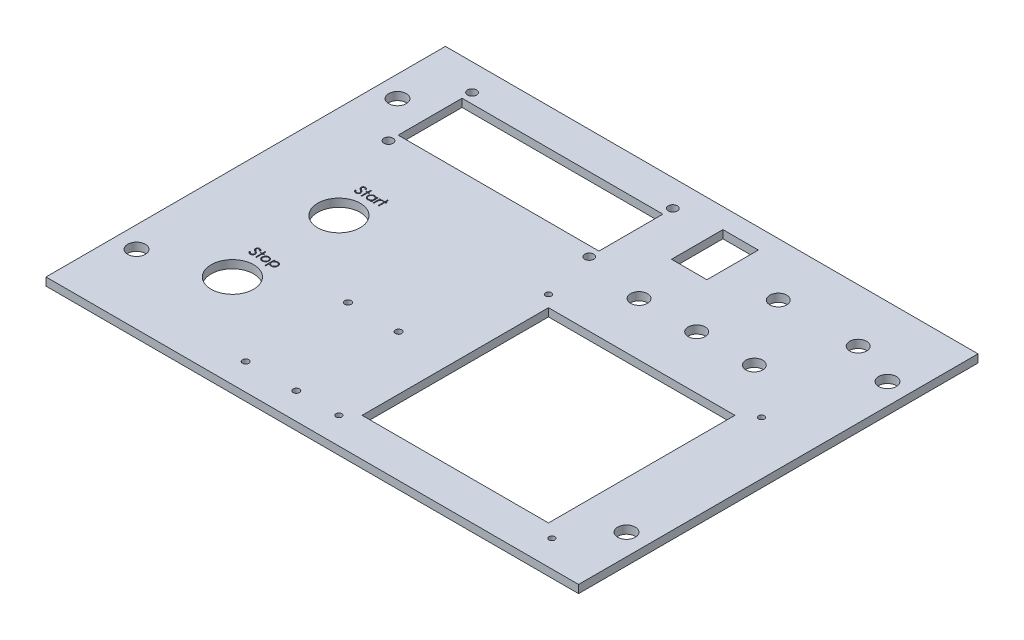
from build123d import *

# Parameters (mm, degrees)
SKETCH1_W           = 200
SKETCH1_H           = 150
BOSS_EXTRUDE1_DEPTH = 3
SKETCH2_R           = 3.3
SKETCH2_R_2         = 1.2
SKETCH2_R_3         = 1.1
SKETCH2_R_4         = 7.985
SKETCH2_R_5         = 3.175
SKETCH2_R_6         = 1.7
SKETCH2_W           = 13.3
SKETCH2_H           = 19.3
SKETCH2_W_2         = 70
SKETCH2_H_2         = 70
SKETCH2_W_3         = 75.4
SKETCH2_H_3         = 24
CUT_EXTRUDE1_DEPTH  = 3
CUT_EXTRUDE2_DEPTH  = 1


with BuildPart() as part:
    # Sketch1 → Boss-Extrude1 (new body)
    with BuildSketch(Plane(origin=(0, 0, 0), x_dir=(1, 0, 0), z_dir=(0, 1, 0))):
        with Locations((100, 75)):
            Rectangle(SKETCH1_W, SKETCH1_H)
    extrude(amount=BOSS_EXTRUDE1_DEPTH)

    # Sketch2 → Cut-Extrude1 (cut)
    with BuildSketch(Plane(origin=(0, 3, 0), x_dir=(1, 0, 0), z_dir=(0, 1, 0))):
        with Locations(Location((8, 124, 0), (0, 0, 270))):
            Circle(SKETCH2_R)
        with Locations(Location((8, 26, 0), (0, 0, 90))):
            Circle(SKETCH2_R)
        with Locations(Location((192, 26, 0), (0, 0, 270))):
            Circle(SKETCH2_R)
        with Locations(Location((192, 124, 0), (0, 0, 90))):
            Circle(SKETCH2_R)
        with Locations(Location((65, 48.4, 0), (0, 0, 270))):
            Circle(SKETCH2_R_2)
        with Locations(Location((84, 48.4, 0), (0, 0, 270))):
            Circle(SKETCH2_R_2)
        with Locations(Location((65, 10, 0), (0, 0, 270))):
            Circle(SKETCH2_R_2)
        with Locations(Location((84, 10, 0), (0, 0, 270))):
            Circle(SKETCH2_R_2)
        with Locations(Location((100, 88.7, 0), (0, 0, 270))):
            Circle(SKETCH2_R_3)
        with Locations(Location((180, 88.7, 0), (0, 0, 270))):
            Circle(SKETCH2_R_3)
        with Locations(Location((180, 10, 0), (0, 0, 270))):
            Circle(SKETCH2_R_3)
        with Locations(Location((100, 10, 0), (0, 0, 270))):
            Circle(SKETCH2_R_3)
        with Locations(Location((35, 35, 0), (0, 0, 270))):
            Circle(SKETCH2_R_4)
        with Locations(Location((35, 75, 0), (0, 0, 270))):
            Circle(SKETCH2_R_4)
        with Locations(Location((145, 130, 0), (0, 0, 270))):
            Circle(SKETCH2_R_5)
        with Locations(Location((175, 130, 0), (0, 0, 270))):
            Circle(SKETCH2_R_5)
        with Locations(Location((20, 140, 0), (0, 0, 270))):
            Circle(SKETCH2_R_6)
        with Locations(Location((95.4, 140, 0), (0, 0, 270))):
            Circle(SKETCH2_R_6)
        with Locations(Location((95.4, 108.6, 0), (0, 0, 270))):
            Circle(SKETCH2_R_6)
        with Locations(Location((20, 108.6, 0), (0, 0, 270))):
            Circle(SKETCH2_R_6)
        with Locations(Location((140, 104.35, 0), (0, 0, 270))):
            Circle(SKETCH2_R_5)
        with Locations(Location((161.65, 104.35, 0), (0, 0, 270))):
            Circle(SKETCH2_R_5)
        with Locations(Location((118.35, 104.35, 0), (0, 0, 270))):
            Circle(SKETCH2_R_5)
        with Locations((118.35, 132.85)):
            Rectangle(SKETCH2_W, SKETCH2_H)
        with Locations((139.35, 49.35)):
            Rectangle(SKETCH2_W_2, SKETCH2_H_2)
        with Locations((57.7, 124.25)):
            Rectangle(SKETCH2_W_3, SKETCH2_H_3)
    extrude(amount=-CUT_EXTRUDE1_DEPTH, mode=Mode.SUBTRACT)

    # Sketch3 → Cut-Extrude2 (cut)
    # profile 1 of 9: a face of its own
    with BuildSketch(Plane(origin=(0, 3, 0), x_dir=(1, 0, 0), z_dir=(0, 1, 0))):
        with BuildLine():
            Line((29.748501989, 86.241905831), (30.044375386, 86.419289645))
            add(Edge.make_bspline(
                [(30.044375386, 86.419289645), (30.071893624, 86.37322526), (30.124617504, 86.284967676), (30.212568863, 86.165709636), (30.303701775, 86.064347479), (30.398691108, 85.981470871), (30.496957056, 85.916221985), (30.59914111, 85.870019753), (30.704898921, 85.841203778), (30.776872742, 85.837703691), (30.812804874, 85.835956312)],
                knots=[0, 0, 0, 0, 1.272034388, 2.437168799, 3.508375237, 4.49857839, 5.41946034, 6.295179144, 7.148887113, 8, 8, 8, 8], degree=3))
            add(Edge.make_bspline(
                [(30.812804874, 85.835956312), (30.843491734, 85.836810984), (30.904328507, 85.838505374), (30.99389075, 85.854786176), (31.080872552, 85.879798305), (31.16348119, 85.915619237), (31.240576805, 85.958957723), (31.3081835, 86.0113039), (31.366629613, 86.069910106), (31.414438728, 86.13529276), (31.451118763, 86.205609909), (31.479310831, 86.27778586), (31.494955905, 86.352954429), (31.497312659, 86.403564892), (31.498501989, 86.42910535)],
                knots=[0, 0, 0, 0, 1.095163259, 2.171163733, 3.241058638, 4.321873601, 5.38011039, 6.391990106, 7.366004449, 8.327778327, 9.272591725, 10.192022065, 11.087607919, 12, 12, 12, 12], degree=3))
            add(Edge.make_bspline(
                [(31.498501989, 86.42910535), (31.497027678, 86.4582462), (31.49403062, 86.517485289), (31.46869914, 86.604884942), (31.428849893, 86.691377512), (31.392087249, 86.744878777), (31.373001188, 86.77265503)],
                knots=[0, 0, 0, 0, 0.938893495, 1.908633276, 2.914225137, 4, 4, 4, 4], degree=3))
            add(Edge.make_bspline(
                [(31.373001188, 86.77265503), (31.357330574, 86.792701853), (31.324432079, 86.834787652), (31.267874567, 86.897432887), (31.201508452, 86.962051306), (31.127604897, 87.031110363), (31.043471809, 87.10139816), (30.951744294, 87.176266438), (30.850080435, 87.252868015), (30.778780939, 87.30424058), (30.741991572, 87.330747978)],
                knots=[0, 0, 0, 0, 0.722233717, 1.516239348, 2.393582979, 3.351407094, 4.387010283, 5.505090956, 6.712668013, 8, 8, 8, 8], degree=3))
            add(Edge.make_bspline(
                [(30.741991572, 87.330747978), (30.705167576, 87.356976566), (30.6347629, 87.407123628), (30.536304317, 87.481547912), (30.448259854, 87.549591782), (30.371020838, 87.611895794), (30.304621241, 87.668468399), (30.24853783, 87.718766338), (30.204199273, 87.764149899), (30.179543692, 87.79359124), (30.168473944, 87.806809677)],
                knots=[0, 0, 0, 0, 1.452282411, 2.77665338, 3.964542531, 5.026858415, 5.96415736, 6.766646006, 7.446254459, 8, 8, 8, 8], degree=3))
            add(Edge.make_bspline(
                [(30.168473944, 87.806809677), (30.153001399, 87.827410714), (30.122572562, 87.867925418), (30.082406557, 87.931250275), (30.048267394, 87.996073541), (30.021505062, 88.062569405), (29.998968843, 88.129804334), (29.983810912, 88.19865558), (29.974319515, 88.268814198), (29.973347529, 88.316027699), (29.972860963, 88.339662241)],
                knots=[0, 0, 0, 0, 1.068054152, 2.10047183, 3.106115577, 4.101338837, 5.06977816, 6.043150881, 7.020423561, 8, 8, 8, 8], degree=3))
            add(Edge.make_bspline(
                [(29.972860963, 88.339662241), (29.974166172, 88.376692016), (29.976748692, 88.449960079), (29.99858921, 88.55699091), (30.033062103, 88.659177327), (30.081356991, 88.755507661), (30.143614344, 88.843473642), (30.215660319, 88.924087129), (30.301471805, 88.991855711), (30.395624428, 89.051067769), (30.4986808, 89.097413694), (30.606671703, 89.132374675), (30.719768776, 89.152183932), (30.79637191, 89.155026697), (30.835240771, 89.156469132)],
                knots=[0, 0, 0, 0, 1.005424448, 1.989358655, 2.955360095, 3.929531133, 4.905563448, 5.876582895, 6.856512386, 7.866279853, 8.892233794, 9.918561126, 10.94386622, 12, 12, 12, 12], degree=3))
            add(Edge.make_bspline(
                [(30.835240771, 89.156469132), (30.876484871, 89.155046581), (30.958506223, 89.152217579), (31.079155439, 89.127620048), (31.195316155, 89.086919376), (31.28875942, 89.040730718), (31.361892181, 88.994599303), (31.417664914, 88.952579478), (31.474182365, 88.90420437), (31.53190042, 88.849345124), (31.589841079, 88.787498373), (31.648864531, 88.719087684), (31.7091088, 88.644531128), (31.74786466, 88.591306627), (31.767732758, 88.564021215)],
                knots=[0, 0, 0, 0, 1.286793592, 2.559021753, 3.825965368, 5.121522368, 5.803751409, 6.523245864, 7.299691795, 8.125521123, 9.008227632, 9.944561021, 10.946284179, 12, 12, 12, 12], degree=3))
            Line((31.767732758, 88.564021215), (31.483778431, 88.348776824))
            add(Edge.make_bspline(
                [(31.483778431, 88.348776824), (31.466632499, 88.370865515), (31.433613442, 88.413403168), (31.383483955, 88.472974484), (31.336235307, 88.527390963), (31.289684907, 88.574656091), (31.246291276, 88.617358225), (31.204174234, 88.653917981), (31.163939882, 88.684693577), (31.113222972, 88.717537137), (31.049505253, 88.75009364), (30.969520717, 88.777642718), (30.885934442, 88.79419778), (30.829004811, 88.796386668), (30.800184681, 88.797494773)],
                knots=[0, 0, 0, 0, 1.181633172, 2.275549214, 3.290209073, 4.226197932, 5.078386478, 5.862611352, 6.581680152, 7.217281963, 8.414376989, 9.595101626, 10.782541182, 12, 12, 12, 12], degree=3))
            add(Edge.make_bspline(
                [(30.800184681, 88.797494773), (30.764028159, 88.796283073), (30.694303712, 88.793946424), (30.595313475, 88.768426439), (30.50621955, 88.728244578), (30.429666985, 88.6719296), (30.365930008, 88.605208608), (30.319824549, 88.528429753), (30.292074385, 88.44364735), (30.288688105, 88.384505694), (30.286963527, 88.354385799)],
                knots=[0, 0, 0, 0, 1.14458467, 2.207223713, 3.21896685, 4.227309161, 5.202851033, 6.127160689, 7.046193047, 8, 8, 8, 8], degree=3))
            add(Edge.make_bspline(
                [(30.286963527, 88.354385799), (30.287356654, 88.33563432), (30.28814355, 88.298100701), (30.299118348, 88.242649279), (30.313217677, 88.187337939), (30.335560309, 88.132415357), (30.366405612, 88.076920998), (30.406910788, 88.01989926), (30.4579241, 87.960847551), (30.497001113, 87.922440178), (30.517632598, 87.902162241)],
                knots=[0, 0, 0, 0, 0.858281714, 1.717966888, 2.583508476, 3.4729293, 4.427298488, 5.488583878, 6.674047936, 8, 8, 8, 8], degree=3))
            add(Edge.make_bspline(
                [(30.517632598, 87.902162241), (30.52529397, 87.895325215), (30.543495638, 87.879082007), (30.576771563, 87.852489726), (30.620714362, 87.819686954), (30.674176563, 87.779099638), (30.738143924, 87.732018175), (30.812623481, 87.679044563), (30.896785013, 87.618459104), (30.956506929, 87.576101564), (30.988085322, 87.553704709)],
                knots=[0, 0, 0, 0, 0.420754252, 0.999615792, 1.744751191, 2.668019286, 3.750313428, 4.999500688, 6.413464383, 8, 8, 8, 8], degree=3))
            add(Edge.make_bspline(
                [(30.988085322, 87.553704709), (31.026071236, 87.526063349), (31.099625692, 87.472539688), (31.204283272, 87.392124008), (31.29917708, 87.313476239), (31.384640284, 87.237098632), (31.461517192, 87.163570539), (31.528954913, 87.092007359), (31.587640593, 87.022921786), (31.650819812, 86.93434921), (31.715377631, 86.825568126), (31.770819138, 86.692289888), (31.805777486, 86.558493567), (31.810349001, 86.468566731), (31.812604553, 86.424197498)],
                knots=[0, 0, 0, 0, 1.163667725, 2.253281268, 3.268753668, 4.215851969, 5.092017293, 5.902905408, 6.650798638, 7.335211899, 8.59617414, 9.77448103, 10.901945474, 12, 12, 12, 12], degree=3))
            add(Edge.make_bspline(
                [(31.812604553, 86.424197498), (31.811947415, 86.392819132), (31.8106459, 86.330671749), (31.795684986, 86.239416672), (31.773765321, 86.150785802), (31.740728087, 86.06587469), (31.700404929, 85.983129927), (31.649238681, 85.904722027), (31.589930996, 85.828915628), (31.521897231, 85.757732137), (31.447451329, 85.692385941), (31.368767634, 85.634256879), (31.285717361, 85.585788556), (31.198751045, 85.546237714), (31.107848708, 85.515304196), (31.013040924, 85.492891327), (30.914171413, 85.479135616), (30.846970931, 85.477707855), (30.812804874, 85.476981953)],
                knots=[0, 0, 0, 0, 0.983748083, 1.948392443, 2.894712957, 3.844097841, 4.80183111, 5.778335162, 6.776009319, 7.81870978, 8.863265674, 9.881300176, 10.883814829, 11.87499822, 12.874611388, 13.892143829, 14.928324115, 16, 16, 16, 16], degree=3))
            add(Edge.make_bspline(
                [(30.812804874, 85.476981953), (30.786369531, 85.477493134), (30.733831771, 85.47850906), (30.656122289, 85.48749034), (30.5799827, 85.500197444), (30.506368418, 85.520371514), (30.434331006, 85.544848491), (30.364183771, 85.574986823), (30.295892717, 85.611104025), (30.229075135, 85.652399049), (30.16390096, 85.700456794), (30.100981492, 85.75643029), (30.038252307, 85.818775795), (29.97756491, 85.889186359), (29.917691766, 85.966524442), (29.859813356, 86.051513625), (29.802731639, 86.143690979), (29.766916171, 86.208556064), (29.748501989, 86.241905831)],
                knots=[0, 0, 0, 0, 0.915332311, 1.819136955, 2.706846663, 3.586547465, 4.459518054, 5.340707479, 6.227863349, 7.133153174, 8.059268498, 9.028702269, 10.047606654, 11.120612155, 12.245963614, 13.433783089, 14.680604001, 16, 16, 16, 16], degree=3))
        make_face()
    # profile 2 of 9: a face of its own
    with BuildSketch(Plane(origin=(0, 3, 0), x_dir=(1, 0, 0), z_dir=(0, 1, 0))):
        Polygon((32.754912245, 89.156469132), (33.06901481, 89.156469132), (33.06901481, 88.12441785), (33.517732758, 88.12441785), (33.517732758, 87.810315286), (33.06901481, 87.810315286), (33.06901481, 85.566725542), (32.754912245, 85.566725542), (32.754912245, 87.810315286), (32.306194297, 87.810315286), (32.306194297, 88.12441785), (32.754912245, 88.12441785), align=None)
    # profile 3 of 9: a face of its own
    with BuildSketch(Plane(origin=(0, 3, 0), x_dir=(1, 0, 0), z_dir=(0, 1, 0))):
        with BuildLine():
            Line((36.658758399, 88.12441785), (36.658758399, 85.566725542))
            Line((36.658758399, 85.566725542), (36.344655835, 85.566725542))
            Line((36.344655835, 85.566725542), (36.344655835, 86.009133395))
            add(Edge.make_bspline(
                [(36.344655835, 86.009133395), (36.309237045, 85.969093801), (36.240116829, 85.89095603), (36.124675711, 85.788873857), (36.002307533, 85.704495536), (35.873606212, 85.63634562), (35.738687969, 85.585153564), (35.597851882, 85.548767405), (35.451040501, 85.52537357), (35.350788146, 85.523037548), (35.299984361, 85.521853748)],
                knots=[0, 0, 0, 0, 1.074387032, 2.096679803, 3.090159297, 4.057316773, 5.018401886, 5.985159533, 6.978961417, 8, 8, 8, 8], degree=3))
            add(Edge.make_bspline(
                [(35.299984361, 85.521853748), (35.254816407, 85.52308012), (35.165743202, 85.52549858), (35.034714125, 85.544260884), (34.908621876, 85.574391505), (34.787347303, 85.616292395), (34.671675157, 85.671873217), (34.560615061, 85.738414465), (34.454742369, 85.817655295), (34.35567083, 85.908243323), (34.264438829, 86.00663831), (34.184377557, 86.111583857), (34.117624477, 86.222626161), (34.061804396, 86.338359315), (34.018808052, 86.459674234), (33.988834418, 86.586151402), (33.970093971, 86.717641276), (33.96767651, 86.807180799), (33.966450707, 86.852582914)],
                knots=[0, 0, 0, 0, 1.033919861, 2.038935746, 3.024066025, 3.998881131, 4.97069526, 5.957263378, 6.95902576, 7.993208707, 9.027059324, 10.027763471, 11.009749337, 11.988697705, 12.965288445, 13.950418724, 14.960734635, 16, 16, 16, 16], degree=3))
            add(Edge.make_bspline(
                [(33.966450707, 86.852582914), (33.967703678, 86.897046618), (33.970180735, 86.984948961), (33.988633955, 87.114227659), (34.019664964, 87.23874592), (34.063212811, 87.358102863), (34.119054766, 87.472442913), (34.186982853, 87.581846938), (34.267001978, 87.686616336), (34.359254385, 87.784287562), (34.459189155, 87.874508177), (34.566097886, 87.952917222), (34.677321167, 88.020634071), (34.794584178, 88.074287547), (34.916151283, 88.117696652), (35.043104729, 88.14772962), (35.174916307, 88.165426941), (35.264406799, 88.167989705), (35.309800066, 88.169289645)],
                knots=[0, 0, 0, 0, 1.020392517, 2.01726096, 2.990465484, 3.961182959, 4.928053699, 5.906110375, 6.912531644, 7.948652711, 8.985773172, 9.998621852, 10.987621588, 11.969261332, 12.953316658, 13.946091881, 14.958173133, 16, 16, 16, 16], degree=3))
            add(Edge.make_bspline(
                [(35.309800066, 88.169289645), (35.361999925, 88.167851893), (35.464361385, 88.16503253), (35.614089394, 88.141569803), (35.755733872, 88.101931336), (35.890388224, 88.048013838), (36.01756891, 87.976365109), (36.136071895, 87.885985148), (36.247137378, 87.777443961), (36.31151767, 87.694073516), (36.344655835, 87.651160639)],
                knots=[0, 0, 0, 0, 1.038897134, 2.037228247, 3.008116434, 3.962042015, 4.918381754, 5.904844433, 6.921570401, 8, 8, 8, 8], degree=3))
            Line((36.344655835, 87.651160639), (36.344655835, 88.12441785))
            Line((36.344655835, 88.12441785), (36.658758399, 88.12441785))
        make_face()
        with BuildLine():
            add(Edge.make_bspline(
                [(35.314006797, 87.855187081), (35.268092459, 87.853553443), (35.177464859, 87.850328902), (35.044420857, 87.825155407), (34.917107443, 87.783270813), (34.796161368, 87.725988911), (34.683493152, 87.653960175), (34.582799481, 87.566838791), (34.49325678, 87.467001777), (34.417948515, 87.354899667), (34.356558019, 87.234721576), (34.313390987, 87.109097138), (34.284921739, 86.98029216), (34.282013219, 86.892929474), (34.280553271, 86.849077305)],
                knots=[0, 0, 0, 0, 1.031046209, 2.035121221, 3.029706178, 4.034933723, 5.034054252, 6.02443088, 7.017295772, 8.038157696, 9.050218397, 10.03989886, 11.016116709, 12, 12, 12, 12], degree=3))
            add(Edge.make_bspline(
                [(34.280553271, 86.849077305), (34.282418164, 86.805487198), (34.286140641, 86.718477842), (34.312891336, 86.589497265), (34.357771209, 86.463843223), (34.419013272, 86.34258223), (34.495699897, 86.229998129), (34.584588549, 86.128258007), (34.68653883, 86.040768419), (34.799466337, 85.967530845), (34.920074308, 85.908368324), (35.046908239, 85.867202685), (35.177583878, 85.840624904), (35.266436211, 85.837520427), (35.31120231, 85.835956312)],
                knots=[0, 0, 0, 0, 0.979072187, 1.954306742, 2.945804271, 3.96968567, 4.997920485, 5.998718438, 6.996577872, 8.005894225, 9.015743152, 10.005417472, 10.995077863, 12, 12, 12, 12], degree=3))
            add(Edge.make_bspline(
                [(35.31120231, 85.835956312), (35.356648812, 85.837616276), (35.447037399, 85.840917779), (35.580476107, 85.866199044), (35.70997107, 85.907967843), (35.833758298, 85.96586697), (35.949074429, 86.037624325), (36.052572307, 86.121631416), (36.140088275, 86.219334601), (36.214280885, 86.326711054), (36.272456301, 86.44442305), (36.31483236, 86.569757241), (36.339886266, 86.702717989), (36.343043996, 86.793581916), (36.344655835, 86.839962722)],
                knots=[0, 0, 0, 0, 1.01762866, 2.023962475, 3.030623092, 4.058876274, 5.077231937, 6.066672613, 7.034107872, 8.005628644, 8.981990164, 9.965428785, 10.961468474, 12, 12, 12, 12], degree=3))
            add(Edge.make_bspline(
                [(36.344655835, 86.839962722), (36.343696179, 86.875300552), (36.341807271, 86.944856586), (36.327376702, 87.046984103), (36.304421775, 87.144717829), (36.272075605, 87.238160518), (36.229584321, 87.326795534), (36.178336555, 87.411259294), (36.117431105, 87.491112505), (36.047848409, 87.565255576), (35.971683207, 87.632882039), (35.891088666, 87.693246279), (35.805109919, 87.742835052), (35.715192882, 87.783876324), (35.621181548, 87.816535473), (35.522310928, 87.838323167), (35.419631941, 87.853283488), (35.349585886, 87.854545869), (35.314006797, 87.855187081)],
                knots=[0, 0, 0, 0, 1.050140795, 2.067009409, 3.05949893, 4.030605086, 5.00011959, 5.97591094, 6.962425594, 7.979863591, 8.993523472, 9.986985069, 10.967611495, 11.937549037, 12.921786183, 13.919465291, 14.943216303, 16, 16, 16, 16], degree=3))
        make_face(mode=Mode.SUBTRACT)
    # profile 4 of 9: a face of its own
    with BuildSketch(Plane(origin=(0, 3, 0), x_dir=(1, 0, 0), z_dir=(0, 1, 0))):
        with BuildLine():
            Line((37.286963527, 88.12441785), (37.601066092, 88.12441785))
            Line((37.601066092, 88.12441785), (37.601066092, 87.747915446))
            add(Edge.make_bspline(
                [(37.601066092, 87.747915446), (37.62425485, 87.782971275), (37.668603171, 87.850015274), (37.742316101, 87.938684575), (37.817819432, 88.012099621), (37.895474619, 88.07060314), (37.975852719, 88.114416259), (38.057189671, 88.146509294), (38.140765141, 88.165486609), (38.196927065, 88.168020268), (38.225064489, 88.169289645)],
                knots=[0, 0, 0, 0, 1.2804753, 2.448899062, 3.506932113, 4.484331642, 5.4025378, 6.288909075, 7.142734305, 8, 8, 8, 8], degree=3))
            add(Edge.make_bspline(
                [(38.225064489, 88.169289645), (38.246890816, 88.168099118), (38.291799901, 88.165649533), (38.359782491, 88.148438708), (38.429825942, 88.120960685), (38.47496833, 88.095120463), (38.498501989, 88.081649421)],
                knots=[0, 0, 0, 0, 0.901110191, 1.854092781, 2.881294221, 4, 4, 4, 4], degree=3))
            Line((38.498501989, 88.081649421), (38.326026027, 87.809614164))
            add(Edge.make_bspline(
                [(38.326026027, 87.809614164), (38.310917006, 87.81635443), (38.282237192, 87.829148746), (38.240282626, 87.844290756), (38.201601289, 87.853206672), (38.17695773, 87.854557389), (38.165469136, 87.855187081)],
                knots=[0, 0, 0, 0, 1.180555205, 2.24091978, 3.179933427, 4, 4, 4, 4], degree=3))
            add(Edge.make_bspline(
                [(38.165469136, 87.855187081), (38.140263403, 87.853507043), (38.088851013, 87.850080254), (38.013366514, 87.823141446), (37.940119308, 87.779616206), (37.881947646, 87.731345094), (37.836905393, 87.684797297), (37.804765167, 87.644148894), (37.77528242, 87.598570263), (37.7471122, 87.548840579), (37.721445906, 87.494110733), (37.697491237, 87.43492752), (37.675832374, 87.371222391), (37.663482129, 87.326839871), (37.657155835, 87.30410535)],
                knots=[0, 0, 0, 0, 1.125678352, 2.296057538, 3.5422874, 4.923748041, 5.663163013, 6.437101912, 7.23742474, 8.08941207, 8.991984279, 9.93940061, 10.944477711, 12, 12, 12, 12], degree=3))
            add(Edge.make_bspline(
                [(37.657155835, 87.30410535), (37.652423442, 87.283828176), (37.64194155, 87.238915778), (37.631750012, 87.163567253), (37.621680494, 87.074543594), (37.614583876, 86.971597001), (37.608005834, 86.854984558), (37.604295752, 86.724528612), (37.601192611, 86.580095261), (37.601109544, 86.479120908), (37.601066092, 86.426300863)],
                knots=[0, 0, 0, 0, 0.566838948, 1.255505196, 2.06880316, 3.007127437, 4.065329342, 5.249902469, 6.561414163, 8, 8, 8, 8], degree=3))
            Line((37.601066092, 86.426300863), (37.601066092, 85.566725542))
            Line((37.601066092, 85.566725542), (37.286963527, 85.566725542))
            Line((37.286963527, 85.566725542), (37.286963527, 88.12441785))
        make_face()
    # profile 5 of 9: a face of its own
    with BuildSketch(Plane(origin=(0, 3, 0), x_dir=(1, 0, 0), z_dir=(0, 1, 0))):
        Polygon((39.126707117, 89.156469132), (39.440809681, 89.156469132), (39.440809681, 88.12441785), (39.88952763, 88.12441785), (39.88952763, 87.810315286), (39.440809681, 87.810315286), (39.440809681, 85.566725542), (39.126707117, 85.566725542), (39.126707117, 87.810315286), (38.677989169, 87.810315286), (38.677989169, 88.12441785), (39.126707117, 88.12441785), align=None)
    # profile 6 of 9: a face of its own
    with BuildSketch(Plane(origin=(0, 3, 0), x_dir=(1, 0, 0), z_dir=(0, 1, 0))):
        with BuildLine():
            Line((29.849101483, 46.490830716), (30.144974881, 46.668214531))
            add(Edge.make_bspline(
                [(30.144974881, 46.668214531), (30.172493118, 46.622150146), (30.225216998, 46.533892562), (30.313168358, 46.414634521), (30.404301269, 46.313272365), (30.499290602, 46.230395757), (30.59755655, 46.16514687), (30.699740604, 46.118944639), (30.805498415, 46.090128663), (30.877472236, 46.086628577), (30.913404368, 46.084881197)],
                knots=[0, 0, 0, 0, 1.272034388, 2.437168799, 3.508375237, 4.49857839, 5.41946034, 6.295179144, 7.148887113, 8, 8, 8, 8], degree=3))
            add(Edge.make_bspline(
                [(30.913404368, 46.084881197), (30.944091228, 46.08573587), (31.004928001, 46.08743026), (31.094490244, 46.103711062), (31.181472047, 46.128723191), (31.264080684, 46.164544122), (31.341176299, 46.207882608), (31.408782994, 46.260228786), (31.467229107, 46.318834991), (31.515038222, 46.384217646), (31.551718257, 46.454534795), (31.579910326, 46.526710746), (31.595555399, 46.601879314), (31.597912153, 46.652489777), (31.599101483, 46.678030236)],
                knots=[0, 0, 0, 0, 1.095163259, 2.171163733, 3.241058638, 4.321873601, 5.38011039, 6.391990106, 7.366004449, 8.327778327, 9.272591725, 10.192022065, 11.087607919, 12, 12, 12, 12], degree=3))
            add(Edge.make_bspline(
                [(31.599101483, 46.678030236), (31.597627172, 46.707171085), (31.594630114, 46.766410175), (31.569298634, 46.853809828), (31.529449387, 46.940302398), (31.492686744, 46.993803663), (31.473600682, 47.021579915)],
                knots=[0, 0, 0, 0, 0.938893495, 1.908633276, 2.914225137, 4, 4, 4, 4], degree=3))
            add(Edge.make_bspline(
                [(31.473600682, 47.021579915), (31.457930068, 47.041626739), (31.425031573, 47.083712537), (31.368474061, 47.146357773), (31.302107946, 47.210976192), (31.228204392, 47.280035249), (31.144071303, 47.350323045), (31.052343788, 47.425191323), (30.950679929, 47.5017929), (30.879380433, 47.553165466), (30.842591066, 47.579672864)],
                knots=[0, 0, 0, 0, 0.722233717, 1.516239348, 2.393582979, 3.351407094, 4.387010283, 5.505090956, 6.712668013, 8, 8, 8, 8], degree=3))
            add(Edge.make_bspline(
                [(30.842591066, 47.579672864), (30.80576707, 47.605901452), (30.735362394, 47.656048514), (30.636903811, 47.730472798), (30.548859348, 47.798516667), (30.471620332, 47.860820679), (30.405220735, 47.917393284), (30.349137324, 47.967691223), (30.304798767, 48.013074784), (30.280143186, 48.042516126), (30.269073438, 48.055734563)],
                knots=[0, 0, 0, 0, 1.452282411, 2.77665338, 3.964542531, 5.026858415, 5.96415736, 6.766646006, 7.446254459, 8, 8, 8, 8], degree=3))
            add(Edge.make_bspline(
                [(30.269073438, 48.055734563), (30.253600893, 48.076335599), (30.223172056, 48.116850303), (30.183006051, 48.180175161), (30.148866888, 48.244998426), (30.122104556, 48.311494291), (30.099568337, 48.37872922), (30.084410406, 48.447580466), (30.074919009, 48.517739084), (30.073947023, 48.564952585), (30.073460457, 48.588587127)],
                knots=[0, 0, 0, 0, 1.068054152, 2.10047183, 3.106115577, 4.101338837, 5.06977816, 6.043150881, 7.020423561, 8, 8, 8, 8], degree=3))
            add(Edge.make_bspline(
                [(30.073460457, 48.588587127), (30.074765666, 48.625616901), (30.077348187, 48.698884965), (30.099188704, 48.805915795), (30.133661597, 48.908102213), (30.181956485, 49.004432546), (30.244213838, 49.092398527), (30.316259813, 49.173012014), (30.402071299, 49.240780596), (30.496223922, 49.299992655), (30.599280294, 49.34633858), (30.707271198, 49.38129956), (30.82036827, 49.401108818), (30.896971404, 49.403951583), (30.935840265, 49.405394018)],
                knots=[0, 0, 0, 0, 1.005424448, 1.989358655, 2.955360095, 3.929531133, 4.905563448, 5.876582895, 6.856512386, 7.866279853, 8.892233794, 9.918561126, 10.94386622, 12, 12, 12, 12], degree=3))
            add(Edge.make_bspline(
                [(30.935840265, 49.405394018), (30.977084365, 49.403971466), (31.059105717, 49.401142465), (31.179754933, 49.376544934), (31.295915649, 49.335844262), (31.389358914, 49.289655604), (31.462491675, 49.243524188), (31.518264408, 49.201504364), (31.574781859, 49.153129255), (31.632499914, 49.098270009), (31.690440573, 49.036423258), (31.749464025, 48.968012569), (31.809708294, 48.893456013), (31.848464154, 48.840231513), (31.868332252, 48.812946101)],
                knots=[0, 0, 0, 0, 1.286793592, 2.559021753, 3.825965368, 5.121522368, 5.803751409, 6.523245864, 7.299691795, 8.125521123, 9.008227632, 9.944561021, 10.946284179, 12, 12, 12, 12], degree=3))
            Line((31.868332252, 48.812946101), (31.584377925, 48.59770171))
            add(Edge.make_bspline(
                [(31.584377925, 48.59770171), (31.567231993, 48.6197904), (31.534212936, 48.662328054), (31.484083449, 48.721899369), (31.436834801, 48.776315849), (31.390284401, 48.823580977), (31.34689077, 48.86628311), (31.304773728, 48.902842867), (31.264539376, 48.933618462), (31.213822466, 48.966462022), (31.150104747, 48.999018526), (31.070120211, 49.026567604), (30.986533936, 49.043122666), (30.929604305, 49.045311554), (30.900784175, 49.046419659)],
                knots=[0, 0, 0, 0, 1.181633172, 2.275549214, 3.290209073, 4.226197932, 5.078386478, 5.862611352, 6.581680152, 7.217281963, 8.414376989, 9.595101626, 10.782541182, 12, 12, 12, 12], degree=3))
            add(Edge.make_bspline(
                [(30.900784175, 49.046419659), (30.864627653, 49.045207959), (30.794903206, 49.04287131), (30.69591297, 49.017351324), (30.606819044, 48.977169464), (30.530266479, 48.920854486), (30.466529502, 48.854133493), (30.420424044, 48.777354638), (30.392673879, 48.692572236), (30.389287599, 48.633430579), (30.387563022, 48.603310684)],
                knots=[0, 0, 0, 0, 1.14458467, 2.207223713, 3.21896685, 4.227309161, 5.202851033, 6.127160689, 7.046193047, 8, 8, 8, 8], degree=3))
            add(Edge.make_bspline(
                [(30.387563022, 48.603310684), (30.387956148, 48.584559206), (30.388743044, 48.547025586), (30.399717842, 48.491574164), (30.413817171, 48.436262825), (30.436159803, 48.381340242), (30.467005106, 48.325845883), (30.507510282, 48.268824146), (30.558523594, 48.209772437), (30.597600607, 48.171365063), (30.618232092, 48.151087127)],
                knots=[0, 0, 0, 0, 0.858281714, 1.717966888, 2.583508476, 3.4729293, 4.427298488, 5.488583878, 6.674047936, 8, 8, 8, 8], degree=3))
            add(Edge.make_bspline(
                [(30.618232092, 48.151087127), (30.625893465, 48.144250101), (30.644095132, 48.128006893), (30.677371057, 48.101414612), (30.721313856, 48.06861184), (30.774776057, 48.028024523), (30.838743419, 47.980943061), (30.913222975, 47.927969449), (30.997384507, 47.86738399), (31.057106423, 47.825026449), (31.088684816, 47.802629595)],
                knots=[0, 0, 0, 0, 0.420754252, 0.999615792, 1.744751191, 2.668019286, 3.750313428, 4.999500688, 6.413464383, 8, 8, 8, 8], degree=3))
            add(Edge.make_bspline(
                [(31.088684816, 47.802629595), (31.12667073, 47.774988235), (31.200225186, 47.721464573), (31.304882766, 47.641048893), (31.399776574, 47.562401125), (31.485239778, 47.486023518), (31.562116686, 47.412495425), (31.629554407, 47.340932244), (31.688240087, 47.271846672), (31.751419306, 47.183274096), (31.815977125, 47.074493012), (31.871418633, 46.941214773), (31.90637698, 46.807418453), (31.910948495, 46.717491616), (31.913204047, 46.673122383)],
                knots=[0, 0, 0, 0, 1.163667725, 2.253281268, 3.268753668, 4.215851969, 5.092017293, 5.902905408, 6.650798638, 7.335211899, 8.59617414, 9.77448103, 10.901945474, 12, 12, 12, 12], degree=3))
            add(Edge.make_bspline(
                [(31.913204047, 46.673122383), (31.912546909, 46.641744018), (31.911245394, 46.579596634), (31.89628448, 46.488341558), (31.874364815, 46.399710688), (31.841327581, 46.314799575), (31.801004423, 46.232054813), (31.749838175, 46.153646912), (31.69053049, 46.077840514), (31.622496725, 46.006657022), (31.548050823, 45.941310826), (31.469367128, 45.883181765), (31.386316855, 45.834713442), (31.299350539, 45.7951626), (31.208448202, 45.764229082), (31.113640418, 45.741816213), (31.014770907, 45.728060502), (30.947570425, 45.726632741), (30.913404368, 45.725906838)],
                knots=[0, 0, 0, 0, 0.983748083, 1.948392443, 2.894712957, 3.844097841, 4.80183111, 5.778335162, 6.776009319, 7.81870978, 8.863265674, 9.881300176, 10.883814829, 11.87499822, 12.874611388, 13.892143829, 14.928324115, 16, 16, 16, 16], degree=3))
            add(Edge.make_bspline(
                [(30.913404368, 45.725906838), (30.886969025, 45.72641802), (30.834431265, 45.727433945), (30.756721783, 45.736415226), (30.680582194, 45.749122329), (30.606967912, 45.769296399), (30.5349305, 45.793773376), (30.464783265, 45.823911709), (30.396492212, 45.86002891), (30.329674629, 45.901323935), (30.264500454, 45.94938168), (30.201580986, 46.005355176), (30.138851801, 46.067700681), (30.078164404, 46.138111244), (30.01829126, 46.215449327), (29.960412851, 46.300438511), (29.903331133, 46.392615864), (29.867515665, 46.45748095), (29.849101483, 46.490830716)],
                knots=[0, 0, 0, 0, 0.915332311, 1.819136955, 2.706846663, 3.586547465, 4.459518054, 5.340707479, 6.227863349, 7.133153174, 8.059268498, 9.028702269, 10.047606654, 11.120612155, 12.245963614, 13.433783089, 14.680604001, 16, 16, 16, 16], degree=3))
        make_face()
    # profile 7 of 9: a face of its own
    with BuildSketch(Plane(origin=(0, 3, 0), x_dir=(1, 0, 0), z_dir=(0, 1, 0))):
        Polygon((32.85551174, 49.405394018), (33.169614304, 49.405394018), (33.169614304, 48.373342736), (33.618332252, 48.373342736), (33.618332252, 48.059240172), (33.169614304, 48.059240172), (33.169614304, 45.815650428), (32.85551174, 45.815650428), (32.85551174, 48.059240172), (32.406793791, 48.059240172), (32.406793791, 48.373342736), (32.85551174, 48.373342736), align=None)
    # profile 8 of 9: a face of its own
    with BuildSketch(Plane(origin=(0, 3, 0), x_dir=(1, 0, 0), z_dir=(0, 1, 0))):
        with BuildLine():
            add(Edge.make_bspline(
                [(35.392170393, 48.418214531), (35.440161666, 48.417192639), (35.534260824, 48.415188961), (35.67206871, 48.393773995), (35.803613846, 48.361026631), (35.929400038, 48.315755069), (36.047816333, 48.255073118), (36.160587577, 48.182663827), (36.267404586, 48.096881233), (36.331427615, 48.030523165), (36.363925201, 47.996840332)],
                knots=[0, 0, 0, 0, 1.054011418, 2.066658804, 3.057071809, 4.030435133, 4.997543892, 5.974964718, 6.972108034, 8, 8, 8, 8], degree=3))
            add(Edge.make_bspline(
                [(36.363925201, 47.996840332), (36.391907155, 47.964626346), (36.447329535, 47.900821804), (36.518395254, 47.797366191), (36.579616814, 47.69022609), (36.628679775, 47.577978764), (36.667364799, 47.461604092), (36.694830495, 47.340702081), (36.71116743, 47.215539734), (36.713370397, 47.130535896), (36.714486099, 47.087485364)],
                knots=[0, 0, 0, 0, 1.025258237, 2.030674902, 3.01204498, 3.988269485, 4.97094183, 5.956517959, 6.965070386, 8, 8, 8, 8], degree=3))
            add(Edge.make_bspline(
                [(36.714486099, 47.087485364), (36.713504761, 47.044185306), (36.711565593, 46.958622373), (36.693221976, 46.832603007), (36.664690891, 46.710408184), (36.623859052, 46.592549491), (36.571500943, 46.478666663), (36.507610256, 46.369257114), (36.431738638, 46.264104981), (36.345734642, 46.164103142), (36.250682766, 46.071936928), (36.147566617, 45.991608658), (36.038412584, 45.922787134), (35.92176923, 45.867350718), (35.798701743, 45.823641018), (35.668944675, 45.792941001), (35.532699605, 45.774379318), (35.439672384, 45.771995744), (35.392170393, 45.770778633)],
                knots=[0, 0, 0, 0, 0.998656419, 1.973391657, 2.932242238, 3.890759089, 4.846373663, 5.82037756, 6.809684879, 7.83454468, 8.860553229, 9.859544525, 10.845671541, 11.83227036, 12.833544569, 13.85385346, 14.904124723, 16, 16, 16, 16], degree=3))
            add(Edge.make_bspline(
                [(35.392170393, 45.770778633), (35.344435674, 45.771999829), (35.250944814, 45.774391604), (35.114218832, 45.792868887), (34.984229213, 45.823626869), (34.861000615, 45.867494362), (34.743855768, 45.922788906), (34.634069271, 45.991400595), (34.530869355, 46.07196075), (34.435797371, 46.164096687), (34.349798766, 46.264106644), (34.273925757, 46.369256682), (34.210035431, 46.478666776), (34.157677227, 46.592549461), (34.116845414, 46.710408192), (34.088314322, 46.832603005), (34.069970707, 46.958622373), (34.068031539, 47.044185306), (34.067050201, 47.087485364)],
                knots=[0, 0, 0, 0, 1.099876186, 2.154163076, 3.173186993, 4.173200201, 5.163417411, 6.152872554, 7.150605724, 8.17532212, 9.198891216, 10.186952605, 11.159729845, 12.11414092, 13.071450619, 14.029093627, 15.002601286, 16, 16, 16, 16], degree=3))
            add(Edge.make_bspline(
                [(34.067050201, 47.087485364), (34.068173511, 47.13030191), (34.070397473, 47.215071312), (34.086717982, 47.339998373), (34.114076538, 47.460695762), (34.152807935, 47.576621238), (34.202323126, 47.688376674), (34.262684414, 47.795781505), (34.334475046, 47.898769305), (34.389676998, 47.962491385), (34.417611099, 47.994736966)],
                knots=[0, 0, 0, 0, 1.031353054, 2.041901799, 3.029428768, 4.008703097, 4.981709435, 5.96992636, 6.972712378, 8, 8, 8, 8], degree=3))
            add(Edge.make_bspline(
                [(34.417611099, 47.994736966), (34.45005969, 48.028711906), (34.513875553, 48.095529602), (34.621224281, 48.181062126), (34.733718102, 48.2549782), (34.853443028, 48.314454415), (34.979125886, 48.361292933), (35.111345129, 48.393858448), (35.249620644, 48.415111803), (35.344180265, 48.417169981), (35.392170393, 48.418214531)],
                knots=[0, 0, 0, 0, 1.027980169, 2.021703884, 2.998553061, 3.971491411, 4.943284454, 5.930300938, 6.949603206, 8, 8, 8, 8], degree=3))
        make_face()
        with BuildLine():
            add(Edge.make_bspline(
                [(35.39076815, 48.104111966), (35.356830538, 48.103147375), (35.28983141, 48.101243092), (35.191211825, 48.086759188), (35.096271671, 48.063811683), (35.004830827, 48.031207627), (34.917197655, 47.989108728), (34.833288252, 47.937400368), (34.752855812, 47.876767412), (34.677473749, 47.80730474), (34.608291437, 47.731425745), (34.54781346, 47.650577387), (34.496388354, 47.56607104), (34.453548195, 47.477818829), (34.421641007, 47.384926415), (34.398467984, 47.288445784), (34.383997744, 47.188180368), (34.382111365, 47.120019349), (34.381152765, 47.085381999)],
                knots=[0, 0, 0, 0, 1.021534396, 2.016698045, 2.994645724, 3.958388632, 4.93408049, 5.916473867, 6.921342795, 7.962252576, 8.998418191, 10.008913653, 10.997312074, 11.973003931, 12.956656626, 13.948281152, 14.957379055, 16, 16, 16, 16], degree=3))
            add(Edge.make_bspline(
                [(34.381152765, 47.085381999), (34.382759589, 47.040629971), (34.385948833, 46.951805566), (34.41188407, 46.820994443), (34.45527035, 46.695412591), (34.513857629, 46.575796205), (34.587263848, 46.465123927), (34.673750915, 46.366452443), (34.772390615, 46.281266631), (34.882007115, 46.210585786), (35.000361433, 46.15442603), (35.125617754, 46.114627054), (35.256258448, 46.088755362), (35.345539179, 46.086183887), (35.39076815, 46.084881197)],
                knots=[0, 0, 0, 0, 1.016792936, 2.018143844, 3.017858371, 4.030088057, 5.03801393, 6.028138512, 7.003788237, 7.991172063, 8.984598303, 9.972568034, 10.972917682, 12, 12, 12, 12], degree=3))
            add(Edge.make_bspline(
                [(35.39076815, 46.084881197), (35.435994519, 46.086191477), (35.525270115, 46.088777934), (35.655729292, 46.114496754), (35.780643263, 46.154600415), (35.898874651, 46.210522625), (36.008441254, 46.281535039), (36.107790376, 46.365971416), (36.193538987, 46.465385268), (36.266872592, 46.575942797), (36.326419334, 46.695227149), (36.369602536, 46.821017621), (36.395600122, 46.951799663), (36.398780951, 47.040627994), (36.400383534, 47.085381999)],
                knots=[0, 0, 0, 0, 1.02726834, 2.027799167, 3.010890988, 4.004497153, 4.992059811, 5.971914811, 6.958719428, 7.966827853, 8.981595046, 9.981490638, 10.983022906, 12, 12, 12, 12], degree=3))
            add(Edge.make_bspline(
                [(36.400383534, 47.085381999), (36.399425264, 47.120019556), (36.397539535, 47.188180982), (36.383064571, 47.288443435), (36.359909031, 47.384935032), (36.327937414, 47.477787035), (36.2852834, 47.56629954), (36.232866607, 47.650329267), (36.172635582, 47.731705813), (36.102618461, 47.807059454), (36.027315083, 47.87679449), (35.946850045, 47.93742388), (35.863065066, 47.988881475), (35.775686483, 48.031567716), (35.684233916, 48.063515056), (35.589426787, 48.086891687), (35.491227977, 48.101181884), (35.424468933, 48.103129026), (35.39076815, 48.104111966)],
                knots=[0, 0, 0, 0, 1.042956736, 2.052379634, 3.044323526, 4.02829302, 5.004299113, 5.996692471, 7.007513377, 8.048758398, 9.090003419, 10.095195979, 11.07790575, 12.047570684, 13.018257071, 13.989683339, 14.985167495, 16, 16, 16, 16], degree=3))
        make_face(mode=Mode.SUBTRACT)
    # profile 9 of 9: a face of its own
    with BuildSketch(Plane(origin=(0, 3, 0), x_dir=(1, 0, 0), z_dir=(0, 1, 0))):
        with BuildLine():
            Line((37.342691227, 48.373342736), (37.656793791, 48.373342736))
            Line((37.656793791, 48.373342736), (37.656793791, 47.900085524))
            add(Edge.make_bspline(
                [(37.656793791, 47.900085524), (37.690151275, 47.943023258), (37.75497487, 48.026464151), (37.866699774, 48.134454279), (37.984626583, 48.225529583), (38.111789996, 48.296912116), (38.246213686, 48.350732928), (38.387346003, 48.390512378), (38.536384768, 48.413953852), (38.638281221, 48.416775514), (38.690247316, 48.418214531)],
                knots=[0, 0, 0, 0, 1.0828784, 2.104357462, 3.088488658, 4.04616522, 5.001424249, 5.969181776, 6.964304535, 8, 8, 8, 8], degree=3))
            add(Edge.make_bspline(
                [(38.690247316, 48.418214531), (38.73563892, 48.416901352), (38.825357808, 48.414305785), (38.957421037, 48.39673273), (39.08459642, 48.366615038), (39.206164474, 48.323214122), (39.32342754, 48.269558652), (39.434649639, 48.201841617), (39.541563195, 48.123435426), (39.641479384, 48.033203275), (39.733800752, 47.935575009), (39.813646933, 47.830552705), (39.882518837, 47.721590118), (39.938189134, 47.606998026), (39.981797481, 47.487678796), (40.012812159, 47.363150355), (40.031269802, 47.233874415), (40.033746254, 47.145971694), (40.034998919, 47.1015078)],
                knots=[0, 0, 0, 0, 1.041296284, 2.058176809, 3.050446431, 4.034000596, 5.01514041, 6.003636468, 7.015969324, 8.052561599, 9.08815499, 10.094063707, 11.074456064, 12.040834395, 13.011057502, 13.983766392, 14.980127149, 16, 16, 16, 16], degree=3))
            add(Edge.make_bspline(
                [(40.034998919, 47.1015078), (40.033773433, 47.056105491), (40.031356599, 46.966565587), (40.012611593, 46.83507849), (39.982654719, 46.708591116), (39.939596536, 46.587313852), (39.883955048, 46.471330201), (39.816250487, 46.360723805), (39.73636402, 46.255530102), (39.645062892, 46.157177202), (39.546009956, 46.066577889), (39.440132467, 45.987339819), (39.329073541, 45.920798444), (39.213401374, 45.865215484), (39.092125736, 45.8233233), (38.965812458, 45.793105499), (38.834530311, 45.774471004), (38.745229159, 45.772018861), (38.700063022, 45.770778633)],
                knots=[0, 0, 0, 0, 1.038740735, 2.04854663, 3.033179607, 4.009277356, 4.987731542, 5.972001279, 6.972200261, 8.005528982, 9.039189865, 10.040446548, 11.026516639, 11.997840187, 12.972163198, 13.956796175, 14.96660207, 16, 16, 16, 16], degree=3))
            add(Edge.make_bspline(
                [(38.700063022, 45.770778633), (38.64923545, 45.772073441), (38.548836094, 45.774631066), (38.402038423, 45.800550476), (38.260761571, 45.839287411), (38.126570747, 45.895986405), (37.998402934, 45.968241921), (37.876983128, 46.056352127), (37.761666375, 46.160132752), (37.692257618, 46.238864568), (37.656793791, 46.279091934)],
                knots=[0, 0, 0, 0, 1.014726462, 2.004382257, 2.969841629, 3.936926163, 4.907207904, 5.903978561, 6.929055279, 8, 8, 8, 8], degree=3))
            Line((37.656793791, 46.279091934), (37.656793791, 44.873342736))
            Line((37.656793791, 44.873342736), (37.342691227, 44.873342736))
            Line((37.342691227, 44.873342736), (37.342691227, 48.373342736))
        make_face()
        with BuildLine():
            add(Edge.make_bspline(
                [(38.687442829, 48.104111966), (38.651863267, 48.103471708), (38.581816279, 48.102211205), (38.47914406, 48.087237256), (38.380248632, 48.065499515), (38.286126681, 48.032587615), (38.195876064, 47.992188801), (38.1101919, 47.94170679), (38.029134332, 47.882054784), (37.952907302, 47.814375441), (37.884044008, 47.739800752), (37.82308108, 47.660212943), (37.771873775, 47.575712804), (37.729371755, 47.487087441), (37.697028472, 47.393642156), (37.674072752, 47.295909143), (37.6596424, 47.193781431), (37.657753462, 47.124225424), (37.656793791, 47.088887607)],
                knots=[0, 0, 0, 0, 1.05670511, 2.080379991, 3.077984906, 4.06214886, 5.038337365, 6.01289324, 7.01187578, 8.025460281, 9.038092164, 10.024533457, 11.000252242, 11.969694649, 12.940728589, 13.933144304, 14.949937299, 16, 16, 16, 16], degree=3))
            add(Edge.make_bspline(
                [(37.656793791, 47.088887607), (37.658384647, 47.042499495), (37.661501269, 46.951621254), (37.686838637, 46.818837132), (37.728073901, 46.693185476), (37.786602614, 46.575724439), (37.860550189, 46.467741604), (37.949648345, 46.371050998), (38.053090896, 46.286260407), (38.169158088, 46.214839153), (38.293580218, 46.156851087), (38.423366131, 46.115336876), (38.556731011, 46.089764648), (38.646899331, 46.086517829), (38.692350682, 46.084881197)],
                knots=[0, 0, 0, 0, 1.03728447, 2.032128127, 3.01272805, 3.987917167, 4.958271349, 5.931593992, 6.91984656, 7.941419022, 8.973179163, 9.983609215, 10.983593296, 12, 12, 12, 12], degree=3))
            add(Edge.make_bspline(
                [(38.692350682, 46.084881197), (38.73688645, 46.086437574), (38.825281943, 46.089526702), (38.955440064, 46.11626489), (39.081930703, 46.157109915), (39.202110875, 46.216669471), (39.314934363, 46.289659529), (39.416815916, 46.377219562), (39.50582283, 46.478709505), (39.581687185, 46.591718008), (39.64281867, 46.712893392), (39.68874891, 46.838274781), (39.715257484, 46.967420204), (39.719014272, 47.054417917), (39.720896355, 47.098002191)],
                knots=[0, 0, 0, 0, 1.00104056, 1.986885549, 2.97790532, 3.984399681, 4.995088187, 5.994304198, 6.996462723, 8.023150851, 9.048424203, 10.043036403, 11.019596776, 12, 12, 12, 12], degree=3))
            add(Edge.make_bspline(
                [(39.720896355, 47.098002191), (39.719441621, 47.14185718), (39.716543487, 47.229225484), (39.68799645, 47.357988387), (39.645096472, 47.483876363), (39.58253742, 47.603396912), (39.50833615, 47.716170995), (39.418589153, 47.815724874), (39.317972957, 47.902895547), (39.205283793, 47.974910957), (39.084343368, 48.032196452), (38.957028452, 48.074080091), (38.823984849, 48.09925384), (38.733357195, 48.102478346), (38.687442829, 48.104111966)],
                knots=[0, 0, 0, 0, 0.983928682, 1.960191568, 2.949917689, 3.96440592, 4.982380491, 5.975291189, 6.965713506, 7.964880129, 8.970154049, 9.96478489, 10.968906225, 12, 12, 12, 12], degree=3))
        make_face(mode=Mode.SUBTRACT)
    extrude(amount=-CUT_EXTRUDE2_DEPTH, mode=Mode.SUBTRACT)


solid = part.part
